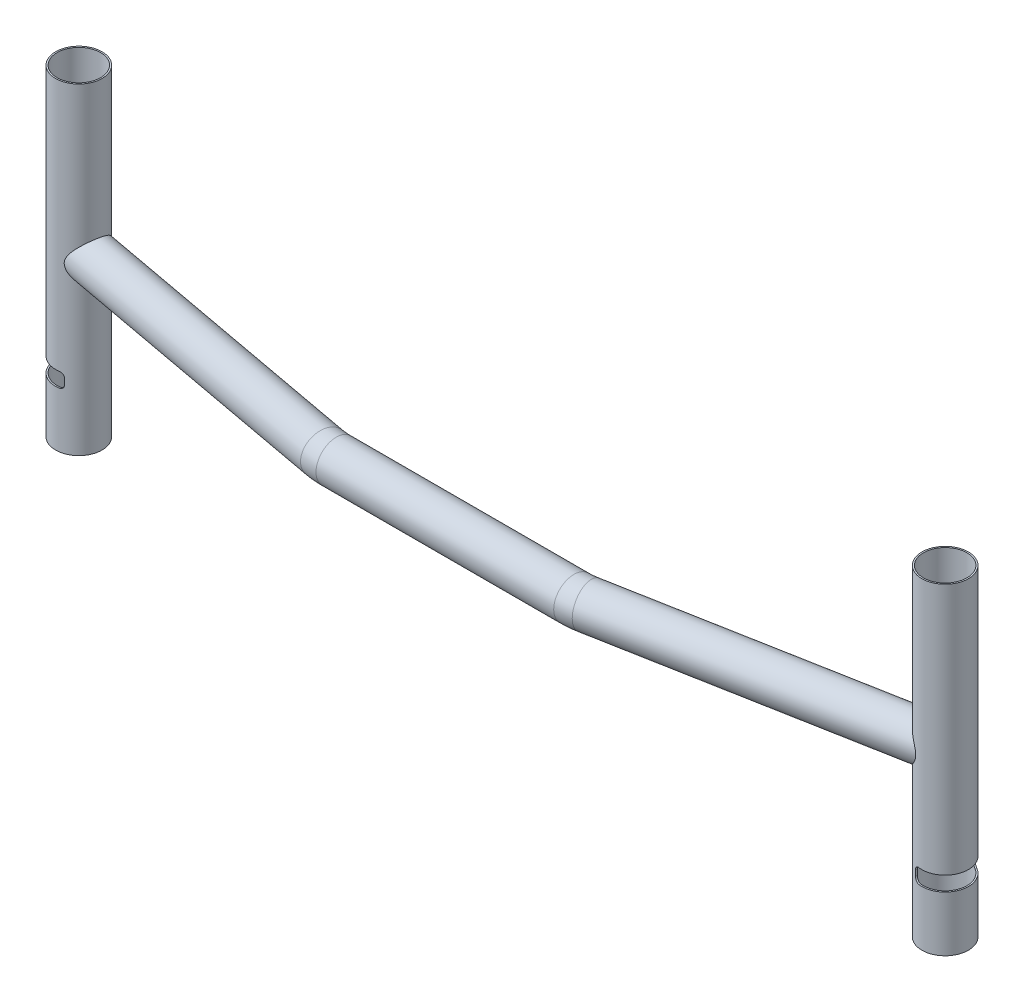
from build123d import *

# Parameters (mm, degrees)
SKETCH2_R           = 11.1
SKETCH2_R_2         = 10.3
BOSS_EXTRUDE1_START = -90.2
SKETCH3_R           = 12.7
SKETCH3_R_2         = 11.9
BOSS_EXTRUDE1_DEPTH = 176
SKETCH4_R           = 11.9
CUT_EXTRUDE1_DEPTH  = 309.534929815
SKETCH5_R           = 10.7
CUT_EXTRUDE2_DEPTH  = 88
CUT_EXTRUDE3_DEPTH  = 20
CUT_EXTRUDE4_REACH  = 270.987
SKETCH8_R           = 3
CUT_EXTRUDE6_REACH  = 274.341
SKETCH11_W          = 4
SKETCH11_H          = 12


with BuildPart() as part:
    # Sweep1: sweep along a path in Sketch1
    with BuildLine(Plane(origin=(0, 0, 0), x_dir=(1, 0, 0), z_dir=(0, 1, 0))) as sweep1_path:
        Line((231, 30), (72.269038036, 0.666031397))
        ThreePointArc((72.269038036, 0.666031397), (68.649743545, 0.16685586), (65, 0))
        Line((65, 0), (-65, 0))
        ThreePointArc((-65, 0), (-68.649743545, 0.16685586), (-72.269038036, 0.666031397))
        Line((-72.269038036, 0.666031397), (-231, 30))
    # Sketch2 → Sweep1 (sweep)
    with BuildSketch(Plane(origin=(231, 0, -30), x_dir=(-0.18172595089967863, 0, -0.9833492150653336), z_dir=(0.9833492150653336, 0, -0.18172595089967863))):
        Circle(SKETCH2_R)
        Circle(SKETCH2_R_2, mode=Mode.SUBTRACT)
    sweep(path=sweep1_path.line)

    # Sketch3 → Boss-Extrude1 (add)
    with BuildSketch(Plane(origin=(0, 0, 0), x_dir=(1, 0, 0), z_dir=(0, 1, 0)).offset(BOSS_EXTRUDE1_START)):
        with Locations((236.90009529, 31.090355705)):
            Circle(SKETCH3_R)
        with Locations((236.90009529, 31.090355705)):
            Circle(SKETCH3_R_2, mode=Mode.SUBTRACT)
    boss_extrude1 = extrude(amount=BOSS_EXTRUDE1_DEPTH)

    # Sketch4 → Cut-Extrude1 (cut, through all)
    with BuildSketch(Plane.XZ.offset(90.2)):
        with Locations((236.90009529, -31.090355705)):
            Circle(SKETCH4_R)
    cut_extrude1 = extrude(amount=-CUT_EXTRUDE1_DEPTH, mode=Mode.SUBTRACT)

    # Sketch5 → Cut-Extrude2 (cut)
    with BuildSketch(Plane(origin=(231, 0, -30), x_dir=(-0.18172595089967863, 0, -0.9833492150653336), z_dir=(0.9833492150653336, 0, -0.18172595089967863))):
        with Locations((-0.014888445, 0)):
            Circle(SKETCH5_R)
    cut_extrude2 = extrude(amount=-CUT_EXTRUDE2_DEPTH, mode=Mode.SUBTRACT)

    # Sketch7 → Cut-Extrude3 (cut, symmetric)
    with BuildSketch(Plane(origin=(236.90009529, 85.8, -31.090355705), x_dir=(-0.9424683764879039, 0, -0.33429531752666614), z_dir=(0.33429531752666614, 0, -0.9424683764879039))):
        with BuildLine():
            Line((-2.5, -137.8), (-12.7, -137.8))
            Line((-12.7, -137.8), (-12.7, -145.8))
            Line((-12.7, -145.8), (-2.5, -145.8))
            ThreePointArc((-2.5, -145.8), (-0.732233047, -145.067766953), (0, -143.3))
            Line((0, -143.3), (0, -140.3))
            ThreePointArc((0, -140.3), (-0.732233047, -138.532233047), (-2.5, -137.8))
        make_face()
    cut_extrude3 = extrude(amount=CUT_EXTRUDE3_DEPTH, both=True, mode=Mode.SUBTRACT)

    # Mirror1: Boss-Extrude1, Cut-Extrude1, Cut-Extrude2, Cut-Extrude3 across plane
    add(boss_extrude1.mirror(Plane(origin=(0, 0, 0), x_dir=(0, 0, 1), z_dir=(1, 0, 0))))
    add(cut_extrude1.mirror(Plane(origin=(0, 0, 0), x_dir=(0, 0, 1), z_dir=(1, 0, 0))), mode=Mode.SUBTRACT)
    add(cut_extrude2.mirror(Plane(origin=(0, 0, 0), x_dir=(0, 0, 1), z_dir=(1, 0, 0))), mode=Mode.SUBTRACT)
    add(cut_extrude3.mirror(Plane(origin=(0, 0, 0), x_dir=(0, 0, 1), z_dir=(1, 0, 0))), mode=Mode.SUBTRACT)

    # Sketch8 → Cut-Extrude4 (cut, up to next)
    with BuildSketch(Plane(origin=(0, 0, 0), x_dir=(1, 0, 0), z_dir=(0, 1, 0)), mode=Mode.PRIVATE) as cut_extrude4_sk1:
        with Locations((216.987516382, 26.593661315)):
            Circle(SKETCH8_R)
    cut_extrude4_tool1 = extrude(cut_extrude4_sk1.sketch, amount=-CUT_EXTRUDE4_REACH, mode=Mode.PRIVATE) & part.part
    add(cut_extrude4_tool1.solids().sort_by_distance((216.987516, 0, -26.593661))[0], mode=Mode.SUBTRACT)

    # Sketch11 → Cut-Extrude6 (cut, up to next)
    with BuildSketch(Plane.XY.offset(-50), mode=Mode.PRIVATE) as cut_extrude6_sk1:
        with Locations((236.90009529, -90.2)):
            Rectangle(SKETCH11_W, SKETCH11_H)
    cut_extrude6_tool1 = extrude(cut_extrude6_sk1.sketch, amount=CUT_EXTRUDE6_REACH, mode=Mode.PRIVATE) & part.part
    cut_extrude6 = cut_extrude6_tool1.solids().sort_by_distance((236.900095, -90.2, -50))[0]
    add(cut_extrude6, mode=Mode.SUBTRACT)

    # Mirror2: Cut-Extrude6 across plane
    add(cut_extrude6.mirror(Plane(origin=(0, 0, 0), x_dir=(0, 0, 1), z_dir=(1, 0, 0))), mode=Mode.SUBTRACT)


solid = part.part
